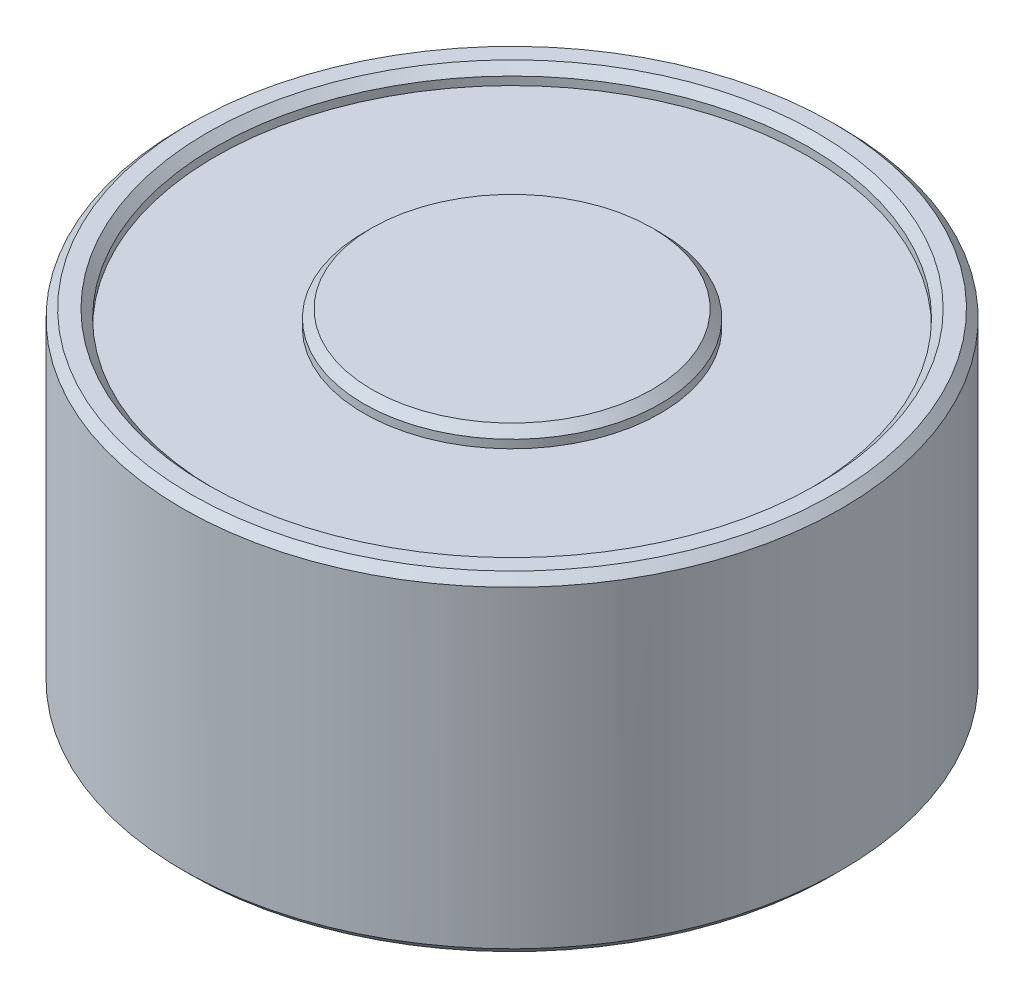
from build123d import *

# Parameters (mm, degrees)
CHAMFER1_SIZE                   = 0.5
M5X0_8_TAPPED_HOLE1_D           = 4.2
M5X0_8_TAPPED_HOLE1_DEPTH       = 13.1381927
M5X0_8_TAPPED_HOLE1_CSINK_D     = 5.05
M5X0_8_TAPPED_HOLE1_CSINK_ANGLE = 90
M5X0_8_TAPPED_HOLE1_TIP         = 1.2618073


with BuildPart() as part:
    # Sketch1 → Revolve1 (revolve)
    with BuildSketch(Plane(origin=(0, 0, 0), x_dir=(0, 0, -1), z_dir=(1, 0, 0))):
        Polygon((0, 0), (20, 0), (20, 20), (18, 20), (18, 19), (9, 19), (9, 20), (0, 20), align=None)
    revolve(axis=Axis((0, 0, 0), (0, 1, 0)))

    # Chamfer1
    chamfer1_edges = [part.edges().sort_by_distance(p)[0] for p in [
        (0, 20, 9),
        (0, 20, 18),
        (0, 20, 20),
        (0, 0, 20),
    ]]
    chamfer(chamfer1_edges, length=CHAMFER1_SIZE)

    # M5x0.8 Tapped Hole1
    with Locations(Plane(origin=(0, 0, 0), x_dir=(-1, 0, 0), z_dir=(0, -1, 0))):
        with Locations((0, 0)):
            CounterSinkHole(M5X0_8_TAPPED_HOLE1_D / 2, M5X0_8_TAPPED_HOLE1_CSINK_D / 2, depth=M5X0_8_TAPPED_HOLE1_DEPTH, counter_sink_angle=M5X0_8_TAPPED_HOLE1_CSINK_ANGLE)
            with Locations((0, 0, -(M5X0_8_TAPPED_HOLE1_DEPTH + M5X0_8_TAPPED_HOLE1_TIP / 2))):  # 118° drill point
                Cone(0, M5X0_8_TAPPED_HOLE1_D / 2, M5X0_8_TAPPED_HOLE1_TIP, mode=Mode.SUBTRACT)


solid = part.part
